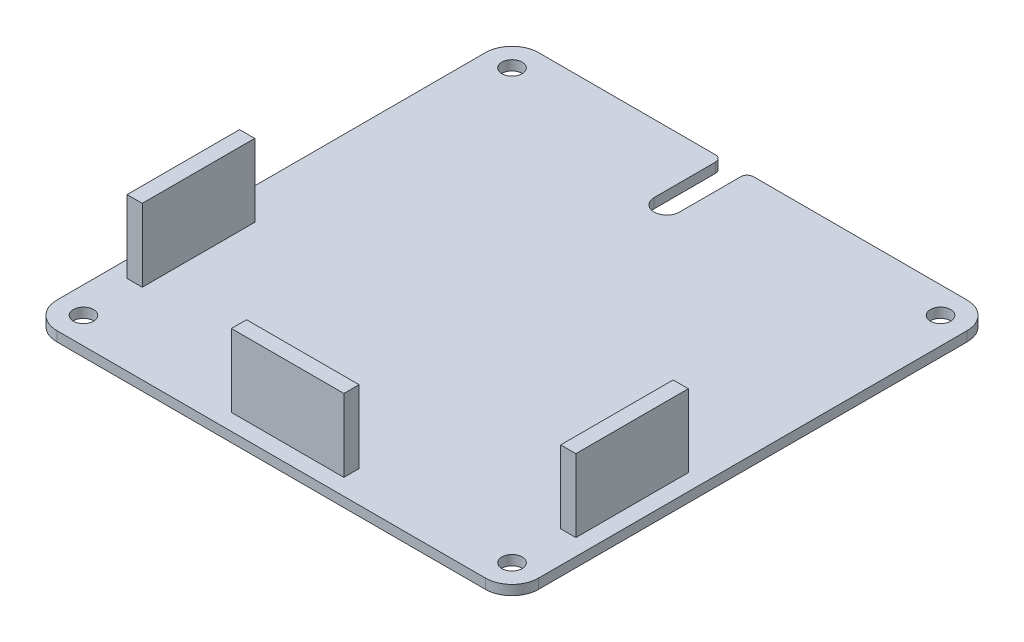
from build123d import *

# Parameters (mm, degrees)
BASE_PLATE_R            = 1.6
PCB_DEPTH               = 1.55
FILLET_1_R              = 1
SKETCH_2_W              = 2.4
SKETCH_2_H              = 17.8
SKETCH_2_W_2            = 17.8
SKETCH_2_H_2            = 2.4
LIDAR_PINS_DEPTH        = 8.5
SKETCH_3_W              = 2.4
SKETCH_3_H              = 17.8
SKETCH_3_W_2            = 17.8
SKETCH_3_H_2            = 2.4
LIDAR_PIN_HEADERS_DEPTH = 3


with BuildPart() as part:
    # Base plate → PCB (new body)
    with BuildSketch(Plane(origin=(0, 0, 0), x_dir=(1, 0, 0), z_dir=(0, 1, 0))):
        with BuildLine():
            ThreePointArc((-38.1, -33.9), (-36.869848481, -36.869848481), (-33.9, -38.1))
            Line((-33.9, -38.1), (33.9, -38.1))
            ThreePointArc((33.9, -38.1), (36.869848481, -36.869848481), (38.1, -33.9))
            Line((38.1, -33.9), (38.1, 33.9))
            ThreePointArc((38.1, 33.9), (36.869848481, 36.869848481), (33.9, 38.1))
            Line((33.9, 38.1), (-0.9, 38.1))
            Line((-0.9, 38.1), (-0.9, 27.4))
            ThreePointArc((-0.9, 27.4), (-2.9, 25.4), (-4.9, 27.4))
            Line((-4.9, 27.4), (-4.9, 38.1))
            Line((-4.9, 38.1), (-33.9, 38.1))
            ThreePointArc((-33.9, 38.1), (-36.869848481, 36.869848481), (-38.1, 33.9))
            Line((-38.1, 33.9), (-38.1, -33.9))
        make_face()
        with Locations(Location((-33.9, -33.9, 0), (0, 0, 90))):
            Circle(BASE_PLATE_R, mode=Mode.SUBTRACT)
        with Locations(Location((33.9, -33.9, 0), (0, 0, 90))):
            Circle(BASE_PLATE_R, mode=Mode.SUBTRACT)
        with Locations(Location((-33.9, 33.9, 0), (0, 0, 90))):
            Circle(BASE_PLATE_R, mode=Mode.SUBTRACT)
        with Locations(Location((33.9, 33.9, 0), (0, 0, 90))):
            Circle(BASE_PLATE_R, mode=Mode.SUBTRACT)
    extrude(amount=PCB_DEPTH)

    # 圆角1
    fillet_1_edges = [part.edges().sort_by_distance(p)[0] for p in [
        (-0.9, 0.775, -38.1),
        (-4.9, 0.775, -38.1),
    ]]
    fillet(fillet_1_edges, radius=FILLET_1_R)

    # 草图2 → Lidar pins (add)
    with BuildSketch(Plane(origin=(0, 1.55, 0), x_dir=(1, 0, 0), z_dir=(0, 1, 0))):
        with Locations((-34.3, -16.5)):
            Rectangle(SKETCH_2_W, SKETCH_2_H)
        with Locations((34.3, -16.5)):
            Rectangle(SKETCH_2_W, SKETCH_2_H)
        with Locations((0, -34.3)):
            Rectangle(SKETCH_2_W_2, SKETCH_2_H_2)
    extrude(amount=LIDAR_PINS_DEPTH)

    # 草图3 → Lidar pin headers (add)
    with BuildSketch(Plane(origin=(0, 10.05, 0), x_dir=(1, 0, 0), z_dir=(0, 1, 0))):
        with Locations((-34.3, -16.5)):
            Rectangle(SKETCH_3_W, SKETCH_3_H)
        with Locations((0, -34.3)):
            Rectangle(SKETCH_3_W_2, SKETCH_3_H_2)
        with Locations((34.3, -16.5)):
            Rectangle(SKETCH_3_W, SKETCH_3_H)
    extrude(amount=LIDAR_PIN_HEADERS_DEPTH)


solid = part.part
